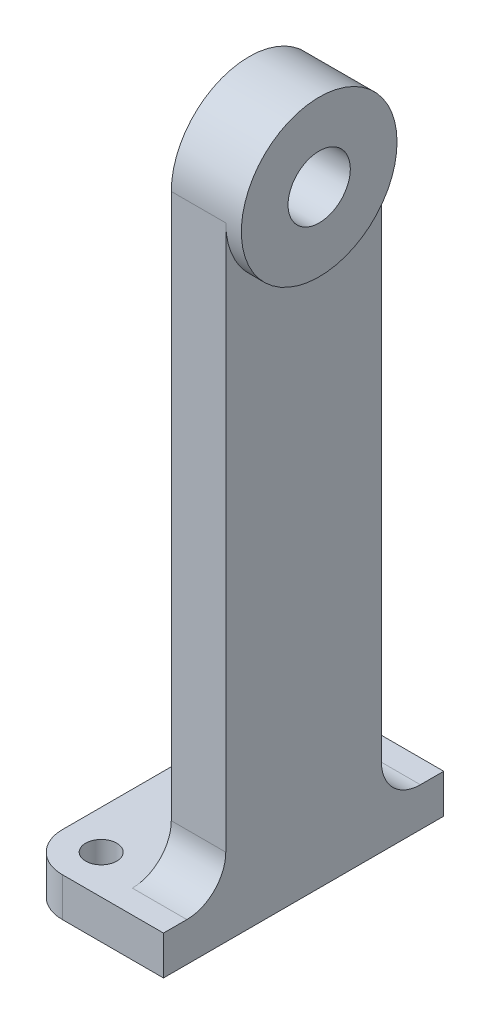
from build123d import *

# Parameters (mm, degrees)
ESQUISSE1_R        = 10
BOSS_EXTRU_1_DEPTH = 25
BOSS_EXTRU_2_DEPTH = 35
BOSS_EXTRU_3_START = -35
ESQUISSE2_4_R      = 50
ESQUISSE2_4_R_2    = 20
BOSS_EXTRU_3_DEPTH = 45


with BuildPart() as part:
    # Esquisse1 → Boss.-Extru.1 (new body)
    with BuildSketch(Plane(origin=(0, 0, 0), x_dir=(1, 0, 0), z_dir=(0, 1, 0))):
        with BuildLine():
            Line((45, -90), (-20, -90))
            ThreePointArc((-20, -90), (-37.67766953, -82.67766953), (-45, -65))
            Line((-45, -65), (-45, 65))
            ThreePointArc((-45, 65), (-37.67766953, 82.67766953), (-20, 90))
            Line((-20, 90), (45, 90))
            Line((45, 90), (45, -90))
        make_face()
        with Locations(Location((-20, 65, 0), (0, 0, 270))):
            Circle(ESQUISSE1_R, mode=Mode.SUBTRACT)
        with Locations(Location((-20, -65, 0), (0, 0, 270))):
            Circle(ESQUISSE1_R, mode=Mode.SUBTRACT)
    extrude(amount=BOSS_EXTRU_1_DEPTH)

    # Esquisse2 → Boss.-Extru.2 (add)
    with BuildSketch(Plane(origin=(45, 0, 0), x_dir=(0, 0, -1), z_dir=(1, 0, 0))):
        with BuildLine():
            Line((-75, 25), (0, 25))
            Line((0, 25), (0, 350))
            ThreePointArc((0, 350), (-35.355339059, 364.644660941), (-50, 400))
            Line((-50, 400), (-50, 50))
            ThreePointArc((-50, 50), (-57.32233047, 32.32233047), (-75, 25))
        make_face()
        with BuildLine():
            Line((0, 350), (0, 25))
            Line((0, 25), (75, 25))
            ThreePointArc((75, 25), (57.32233047, 32.32233047), (50, 50))
            Line((50, 50), (50, 400))
            ThreePointArc((50, 400), (35.355339059, 364.644660941), (0, 350))
        make_face()
    extrude(amount=-BOSS_EXTRU_2_DEPTH)

    # Esquisse2<4> → Boss.-Extru.3 (add)
    with BuildSketch(Plane(origin=(45, 0, 0), x_dir=(0, 0, -1), z_dir=(1, 0, 0)).offset(BOSS_EXTRU_3_START)):
        with Locations((0, 400)):
            Circle(ESQUISSE2_4_R)
        with Locations((0, 400)):
            Circle(ESQUISSE2_4_R_2, mode=Mode.SUBTRACT)
    extrude(amount=BOSS_EXTRU_3_DEPTH)


solid = part.part
